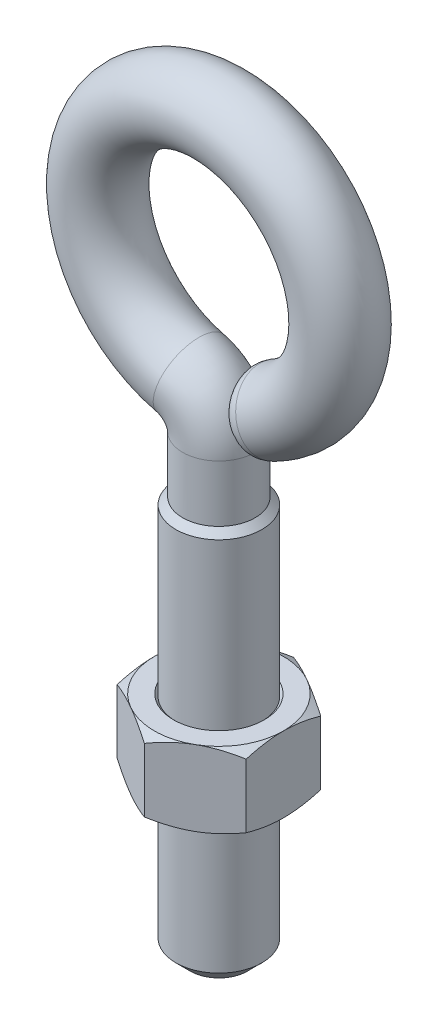
from build123d import *

# Parameters (mm, degrees)
BOSS_EXTRUDE1_START = -11.811
SKETCH2_R           = 2.413
BOSS_EXTRUDE1_DEPTH = 22.225
SKETCH5_OUTSIDE_W   = 55.926
SKETCH5_OUTSIDE_H   = 55.926
SKETCH5_OUTSIDE_R   = 1.611024392
CUT_EXTRUDE1_DEPTH  = 22.225
CUT_EXTRUDE1_DRAFT  = -45
SKETCH6_OUTSIDE_W   = 55.926
SKETCH6_OUTSIDE_H   = 55.926
SKETCH6_OUTSIDE_R   = 2.032
CUT_EXTRUDE2_DEPTH  = 22.225
CUT_EXTRUDE2_DRAFT  = -45
SKETCH7_R           = 2.032
FILLET1_R           = 1.2065
BOSS_EXTRUDE2_START = -8.4455
SKETCH9_R           = 2.413
BOSS_EXTRUDE2_DEPTH = 4.22275


with BuildPart() as part:
    # Sketch2 → Boss-Extrude1 (new body)
    with BuildSketch(Plane(origin=(0, 0, 0), x_dir=(1, 0, 0), z_dir=(0, 1, 0)).offset(BOSS_EXTRUDE1_START)):
        with Locations(Location((0, 0, 0), (0, 0, 270))):
            Circle(SKETCH2_R)
    extrude(amount=-BOSS_EXTRUDE1_DEPTH)


with BuildPart() as cut_extrude1_tool:
    # Sketch5 outside → Cut-Extrude1 (with draft: the straight prism first)
    with BuildSketch(Plane.XZ.offset(34.036)):
        Rectangle(SKETCH5_OUTSIDE_W, SKETCH5_OUTSIDE_H)
        Circle(SKETCH5_OUTSIDE_R, mode=Mode.SUBTRACT)
    extrude(amount=-CUT_EXTRUDE1_DEPTH)
    # Cut-Extrude1: the draft: its side faces are tilted about the plane it starts from
    cut_extrude1_sides = [cut_extrude1_tool.faces().sort_by_distance(p)[0] for p in [
        (0, -22.9235, -27.963),
        (27.963, -22.9235, 0),
        (0, -22.9235, 27.963),
        (-27.963, -22.9235, 0),
        (-1.611024392, -22.9235, 0),
    ]]
    draft(cut_extrude1_sides, Plane.XZ.offset(34.036), CUT_EXTRUDE1_DRAFT)


with BuildPart() as part_1:
    add(part.part)

    # Cut-Extrude1: cut by cut_extrude1_tool
    add(cut_extrude1_tool.part, mode=Mode.SUBTRACT)


with BuildPart() as cut_extrude2_tool:
    # Sketch6 outside → Cut-Extrude2 (with draft: the straight prism first)
    with BuildSketch(Plane(origin=(0, -11.811, 0), x_dir=(1, 0, 0), z_dir=(0, 1, 0))):
        Rectangle(SKETCH6_OUTSIDE_W, SKETCH6_OUTSIDE_H)
        Circle(SKETCH6_OUTSIDE_R, mode=Mode.SUBTRACT)
    extrude(amount=-CUT_EXTRUDE2_DEPTH)
    # Cut-Extrude2: the draft: its side faces are tilted about the plane it starts from
    cut_extrude2_sides = [cut_extrude2_tool.faces().sort_by_distance(p)[0] for p in [
        (0, -22.9235, 27.963),
        (27.963, -22.9235, 0),
        (0, -22.9235, -27.963),
        (-27.963, -22.9235, 0),
        (-2.032, -22.9235, 0),
    ]]
    draft(cut_extrude2_sides, Plane(origin=(0, -11.811, 0), x_dir=(1, 0, 0), z_dir=(0, 1, 0)), CUT_EXTRUDE2_DRAFT)


with BuildPart() as part_2:
    add(part_1.part)

    # Cut-Extrude2: cut by cut_extrude2_tool
    add(cut_extrude2_tool.part, mode=Mode.SUBTRACT)

    # Sweep1: sweep along a path in Sketch8
    with BuildLine(Plane.XY) as sweep1_path:
        Line((0, -11.811), (0, -8.636))
        ThreePointArc((0, -8.636), (-0.447657805, -7.343037758), (-1.598959476, -6.603677676))
        ThreePointArc((-1.598959476, -6.603677676), (-0.212740878, 6.791168645), (2.009153775, -6.490649533))
    # Sketch7 → Sweep1 (sweep)
    with BuildSketch(Plane(origin=(0, -11.811, 0), x_dir=(1, 0, 0), z_dir=(0, 1, 0))):
        Circle(SKETCH7_R)
    sweep(path=sweep1_path.line)

    # Fillet1
    fillet1_edges = [part_2.edges().sort_by_distance(p)[0] for p in [
        (2.610022194, -8.431778365, 0),
    ]]
    fillet(fillet1_edges, radius=FILLET1_R)


with BuildPart() as body_2:
    # Sketch9 → Boss-Extrude2 (new body)
    with BuildSketch(Plane.XZ.offset(34.036).offset(BOSS_EXTRUDE2_START)):
        Polygon((0, 4.179438599), (-3.6195, 2.089719299), (-3.6195, -2.089719299), (0, -4.179438599), (3.6195, -2.089719299), (3.6195, 2.089719299), align=None)
        with Locations(Location((0, 0, 0), (0, 0, 270))):
            Circle(SKETCH9_R, mode=Mode.SUBTRACT)
    extrude(amount=-BOSS_EXTRUDE2_DEPTH)

    # Sketch10 → Cut-Revolve1 (revolve, cut)
    with BuildSketch(Plane(origin=(0, 0, 0), x_dir=(0, 0, -1), z_dir=(1, 0, 0)), mode=Mode.PRIVATE) as cut_revolve1_sk:
        Polygon((-3.6195, -21.36775), (-4.739377197, -21.36775), (-4.739377197, -25.5905), (-3.6195, -25.5905), (-4.179438599, -25.267219299), (-4.179438599, -21.691030701), align=None)
        Polygon((-2.280708333, -21.36775), (-2.280708333, -25.5905), (-2.545291667, -25.5905), (-2.413, -25.458208333), (-2.413, -21.500041667), (-2.545291667, -21.36775), align=None)
    revolve(cut_revolve1_sk.sketch.rotate(Axis((0, -8.636, 0), (0, -1, 0)), 90), axis=Axis((0, -8.636, 0), (0, -1, 0)), mode=Mode.SUBTRACT)


solid = Compound([part_2.part, body_2.part])
